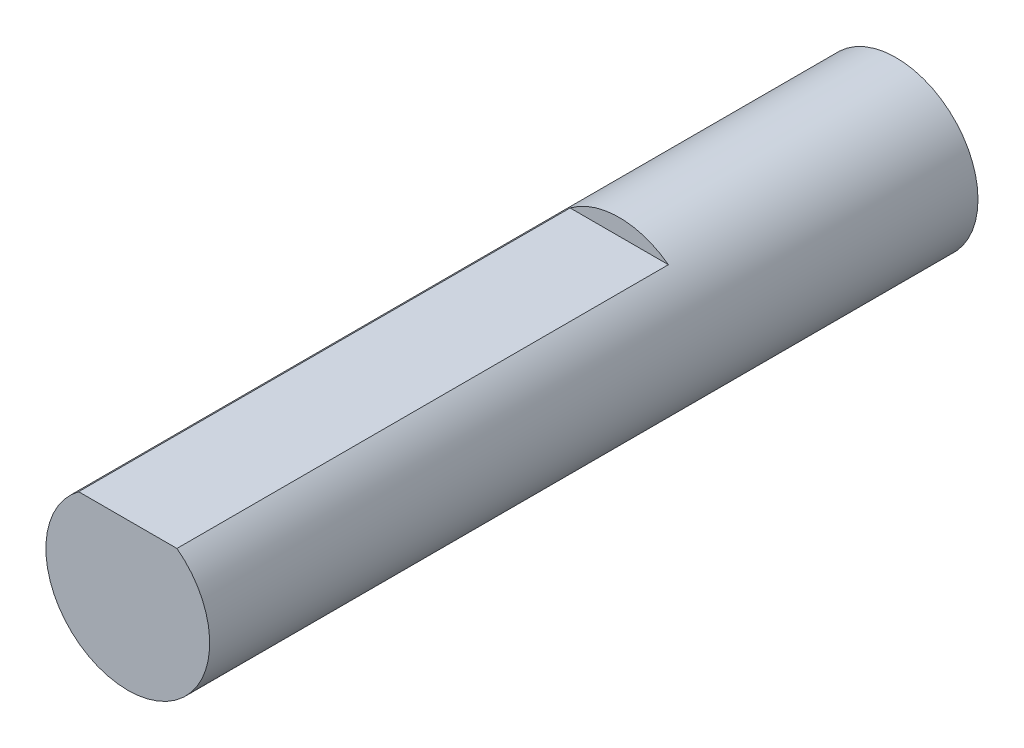
from build123d import *

# Parameters (mm, degrees)
SKETCH1_R           = 2.5
BOSS_EXTRUDE1_DEPTH = 23.45
CUT_EXTRUDE1_START  = -15
CUT_EXTRUDE1_DEPTH  = 15


with BuildPart() as part:
    # Sketch1 → Boss-Extrude1 (new body)
    with BuildSketch(Plane.XY):
        Circle(SKETCH1_R)
    extrude(amount=BOSS_EXTRUDE1_DEPTH)

    # Sketch2 → Cut-Extrude1 (cut)
    with BuildSketch(Plane.XY.offset(23.45).offset(CUT_EXTRUDE1_START)):
        with BuildLine():
            Line((-1.5, 2), (1.5, 2))
            ThreePointArc((1.5, 2), (0, 2.5), (-1.5, 2))
        make_face()
    extrude(amount=CUT_EXTRUDE1_DEPTH, mode=Mode.SUBTRACT)


solid = part.part
